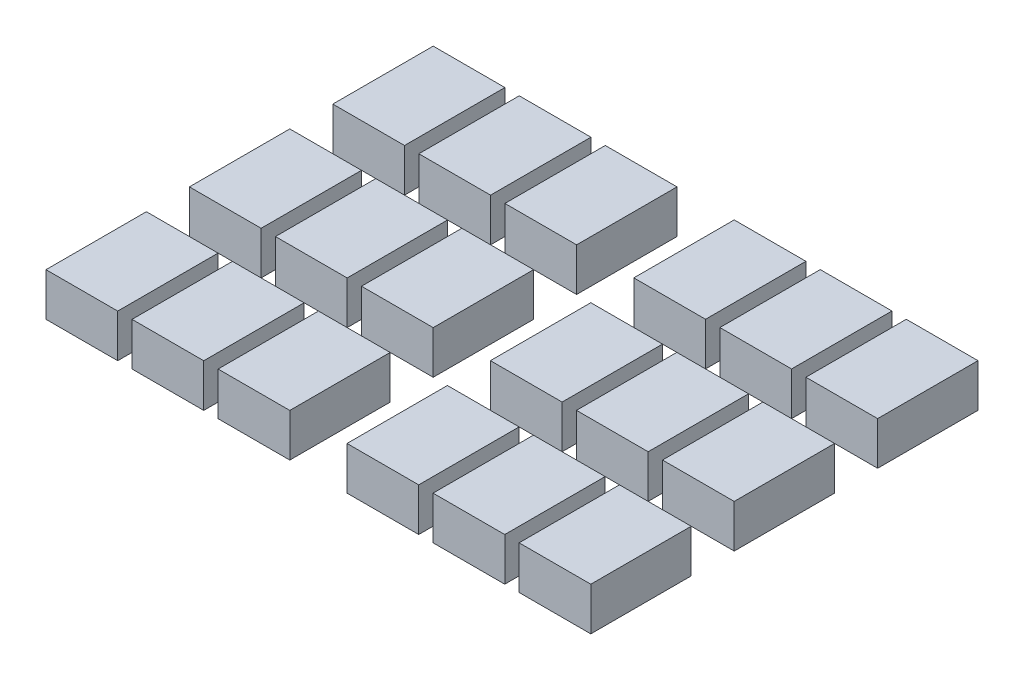
from build123d import *

# Parameters (mm, degrees)
FIRST_CLASS_SEAT_2_W       = 508.000000102
FIRST_CLASS_SEAT_2_H       = 711.199999899
FIRST_CLASS_SEAT_DEPTH     = 304.8
FIRST_CLASS_SEAT_2_2_DEPTH = 304.8
FIRST_CLASS_SEAT_2_W_2     = 508.000000101
FIRST_CLASS_SEAT_3_DEPTH   = 304.8
FIRST_CLASS_SEAT_2_H_2     = 711.199999898
FIRST_CLASS_SEAT_4_DEPTH   = 304.8
FIRST_CLASS_SEAT_5_DEPTH   = 304.8
FIRST_CLASS_SEAT_6_DEPTH   = 304.8
FIRST_CLASS_SEAT_7_DEPTH   = 304.8
FIRST_CLASS_SEAT_8_DEPTH   = 304.8
FIRST_CLASS_SEAT_9_DEPTH   = 304.8
FIRST_CLASS_SEAT_10_DEPTH  = 304.8
FIRST_CLASS_SEAT_11_DEPTH  = 304.8
FIRST_CLASS_SEAT_12_DEPTH  = 304.8
FIRST_CLASS_SEAT_13_DEPTH  = 304.8
FIRST_CLASS_SEAT_14_DEPTH  = 304.8
FIRST_CLASS_SEAT_15_DEPTH  = 304.8
FIRST_CLASS_SEAT_16_DEPTH  = 304.8
FIRST_CLASS_SEAT_17_DEPTH  = 304.8
FIRST_CLASS_SEAT_18_DEPTH  = 304.8


with BuildPart() as part:
    # First Class Seat 2 → First Class Seat (new body)
    with BuildSketch(Plane(origin=(0, 0, 0), x_dir=(1, 0, 0), z_dir=(0, 1, 0))):
        with Locations((-1066.291998811, 13503.187169787)):
            Rectangle(FIRST_CLASS_SEAT_2_W, FIRST_CLASS_SEAT_2_H)
    extrude(amount=FIRST_CLASS_SEAT_DEPTH)


with BuildPart() as body_2:
    # First Class Seat 2 → First Class Seat 2 2 (new body)
    with BuildSketch(Plane(origin=(0, 0, 0), x_dir=(1, 0, 0), z_dir=(0, 1, 0))):
        with Locations((-1675.891998933, 13503.187169787)):
            Rectangle(FIRST_CLASS_SEAT_2_W, FIRST_CLASS_SEAT_2_H)
    extrude(amount=FIRST_CLASS_SEAT_2_2_DEPTH)


with BuildPart() as body_3:
    # First Class Seat 2 → First Class Seat 3 (new body)
    with BuildSketch(Plane(origin=(0, 0, 0), x_dir=(1, 0, 0), z_dir=(0, 1, 0))):
        with Locations((-456.691998689, 13503.187169787)):
            Rectangle(FIRST_CLASS_SEAT_2_W_2, FIRST_CLASS_SEAT_2_H)
    extrude(amount=FIRST_CLASS_SEAT_3_DEPTH)


with BuildPart() as body_4:
    # First Class Seat 2 → First Class Seat 4 (new body)
    with BuildSketch(Plane(origin=(0, 0, 0), x_dir=(1, 0, 0), z_dir=(0, 1, 0))):
        with Locations((-1066.291998811, 14519.187169685)):
            Rectangle(FIRST_CLASS_SEAT_2_W, FIRST_CLASS_SEAT_2_H_2)
    extrude(amount=FIRST_CLASS_SEAT_4_DEPTH)


with BuildPart() as body_5:
    # First Class Seat 2 → First Class Seat 5 (new body)
    with BuildSketch(Plane(origin=(0, 0, 0), x_dir=(1, 0, 0), z_dir=(0, 1, 0))):
        with Locations((-456.691998689, 14519.187169685)):
            Rectangle(FIRST_CLASS_SEAT_2_W_2, FIRST_CLASS_SEAT_2_H_2)
    extrude(amount=FIRST_CLASS_SEAT_5_DEPTH)


with BuildPart() as body_6:
    # First Class Seat 2 → First Class Seat 6 (new body)
    with BuildSketch(Plane(origin=(0, 0, 0), x_dir=(1, 0, 0), z_dir=(0, 1, 0))):
        with Locations((-1066.291998811, 15535.187169583)):
            Rectangle(FIRST_CLASS_SEAT_2_W, FIRST_CLASS_SEAT_2_H_2)
    extrude(amount=FIRST_CLASS_SEAT_6_DEPTH)


with BuildPart() as body_7:
    # First Class Seat 2 → First Class Seat 7 (new body)
    with BuildSketch(Plane(origin=(0, 0, 0), x_dir=(1, 0, 0), z_dir=(0, 1, 0))):
        with Locations((-456.691998689, 15535.187169583)):
            Rectangle(FIRST_CLASS_SEAT_2_W_2, FIRST_CLASS_SEAT_2_H_2)
    extrude(amount=FIRST_CLASS_SEAT_7_DEPTH)


with BuildPart() as body_8:
    # First Class Seat 2 → First Class Seat 8 (new body)
    with BuildSketch(Plane(origin=(0, 0, 0), x_dir=(1, 0, 0), z_dir=(0, 1, 0))):
        with Locations((-1675.891998933, 14519.187169685)):
            Rectangle(FIRST_CLASS_SEAT_2_W, FIRST_CLASS_SEAT_2_H_2)
    extrude(amount=FIRST_CLASS_SEAT_8_DEPTH)


with BuildPart() as body_9:
    # First Class Seat 2 → First Class Seat 9 (new body)
    with BuildSketch(Plane(origin=(0, 0, 0), x_dir=(1, 0, 0), z_dir=(0, 1, 0))):
        with Locations((-1675.891998933, 15535.187169583)):
            Rectangle(FIRST_CLASS_SEAT_2_W, FIRST_CLASS_SEAT_2_H_2)
    extrude(amount=FIRST_CLASS_SEAT_9_DEPTH)


with BuildPart() as body_10:
    # First Class Seat 2 → First Class Seat 10 (new body)
    with BuildSketch(Plane(origin=(0, 0, 0), x_dir=(1, 0, 0), z_dir=(0, 1, 0))):
        with Locations((1675.891998933, 15535.187169583)):
            Rectangle(FIRST_CLASS_SEAT_2_W, FIRST_CLASS_SEAT_2_H_2)
    extrude(amount=FIRST_CLASS_SEAT_10_DEPTH)


with BuildPart() as body_11:
    # First Class Seat 2 → First Class Seat 11 (new body)
    with BuildSketch(Plane(origin=(0, 0, 0), x_dir=(1, 0, 0), z_dir=(0, 1, 0))):
        with Locations((1675.891998933, 14519.187169685)):
            Rectangle(FIRST_CLASS_SEAT_2_W, FIRST_CLASS_SEAT_2_H_2)
    extrude(amount=FIRST_CLASS_SEAT_11_DEPTH)


with BuildPart() as body_12:
    # First Class Seat 2 → First Class Seat 12 (new body)
    with BuildSketch(Plane(origin=(0, 0, 0), x_dir=(1, 0, 0), z_dir=(0, 1, 0))):
        with Locations((456.691998689, 15535.187169583)):
            Rectangle(FIRST_CLASS_SEAT_2_W_2, FIRST_CLASS_SEAT_2_H_2)
    extrude(amount=FIRST_CLASS_SEAT_12_DEPTH)


with BuildPart() as body_13:
    # First Class Seat 2 → First Class Seat 13 (new body)
    with BuildSketch(Plane(origin=(0, 0, 0), x_dir=(1, 0, 0), z_dir=(0, 1, 0))):
        with Locations((1066.291998811, 15535.187169583)):
            Rectangle(FIRST_CLASS_SEAT_2_W, FIRST_CLASS_SEAT_2_H_2)
    extrude(amount=FIRST_CLASS_SEAT_13_DEPTH)


with BuildPart() as body_14:
    # First Class Seat 2 → First Class Seat 14 (new body)
    with BuildSketch(Plane(origin=(0, 0, 0), x_dir=(1, 0, 0), z_dir=(0, 1, 0))):
        with Locations((456.691998689, 14519.187169685)):
            Rectangle(FIRST_CLASS_SEAT_2_W_2, FIRST_CLASS_SEAT_2_H_2)
    extrude(amount=FIRST_CLASS_SEAT_14_DEPTH)


with BuildPart() as body_15:
    # First Class Seat 2 → First Class Seat 15 (new body)
    with BuildSketch(Plane(origin=(0, 0, 0), x_dir=(1, 0, 0), z_dir=(0, 1, 0))):
        with Locations((1066.291998811, 14519.187169685)):
            Rectangle(FIRST_CLASS_SEAT_2_W, FIRST_CLASS_SEAT_2_H_2)
    extrude(amount=FIRST_CLASS_SEAT_15_DEPTH)


with BuildPart() as body_16:
    # First Class Seat 2 → First Class Seat 16 (new body)
    with BuildSketch(Plane(origin=(0, 0, 0), x_dir=(1, 0, 0), z_dir=(0, 1, 0))):
        with Locations((456.691998689, 13503.187169787)):
            Rectangle(FIRST_CLASS_SEAT_2_W_2, FIRST_CLASS_SEAT_2_H)
    extrude(amount=FIRST_CLASS_SEAT_16_DEPTH)


with BuildPart() as body_17:
    # First Class Seat 2 → First Class Seat 17 (new body)
    with BuildSketch(Plane(origin=(0, 0, 0), x_dir=(1, 0, 0), z_dir=(0, 1, 0))):
        with Locations((1066.291998811, 13503.187169787)):
            Rectangle(FIRST_CLASS_SEAT_2_W, FIRST_CLASS_SEAT_2_H)
    extrude(amount=FIRST_CLASS_SEAT_17_DEPTH)


with BuildPart() as body_18:
    # First Class Seat 2 → First Class Seat 18 (new body)
    with BuildSketch(Plane(origin=(0, 0, 0), x_dir=(1, 0, 0), z_dir=(0, 1, 0))):
        with Locations((1675.891998933, 13503.187169787)):
            Rectangle(FIRST_CLASS_SEAT_2_W, FIRST_CLASS_SEAT_2_H)
    extrude(amount=FIRST_CLASS_SEAT_18_DEPTH)


solid = Compound([part.part, body_2.part, body_3.part, body_4.part, body_5.part, body_6.part, body_7.part, body_8.part, body_9.part, body_10.part, body_11.part, body_12.part, body_13.part, body_14.part, body_15.part, body_16.part, body_17.part, body_18.part])
